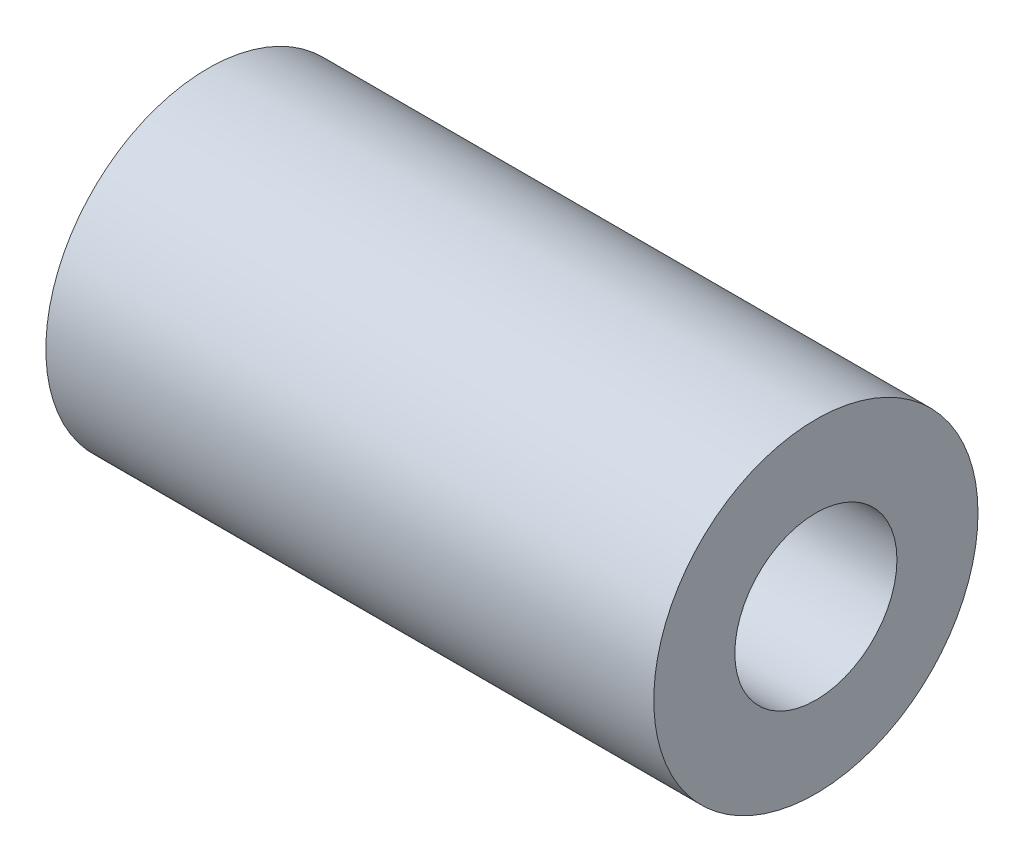
from build123d import *

# Parameters (mm, degrees)
SKETCH1_R           = 4
SKETCH1_R_2         = 2
BOSS_EXTRUDE1_DEPTH = 15


with BuildPart() as part:
    # Sketch1 → Boss-Extrude1 (new body)
    with BuildSketch(Plane.YZ):
        with Locations(Location((0, 0, 0), (0, 0, 270))):
            Circle(SKETCH1_R)
        with Locations(Location((0, 0, 0), (0, 0, 270))):
            Circle(SKETCH1_R_2, mode=Mode.SUBTRACT)
    extrude(amount=BOSS_EXTRUDE1_DEPTH)


solid = part.part
